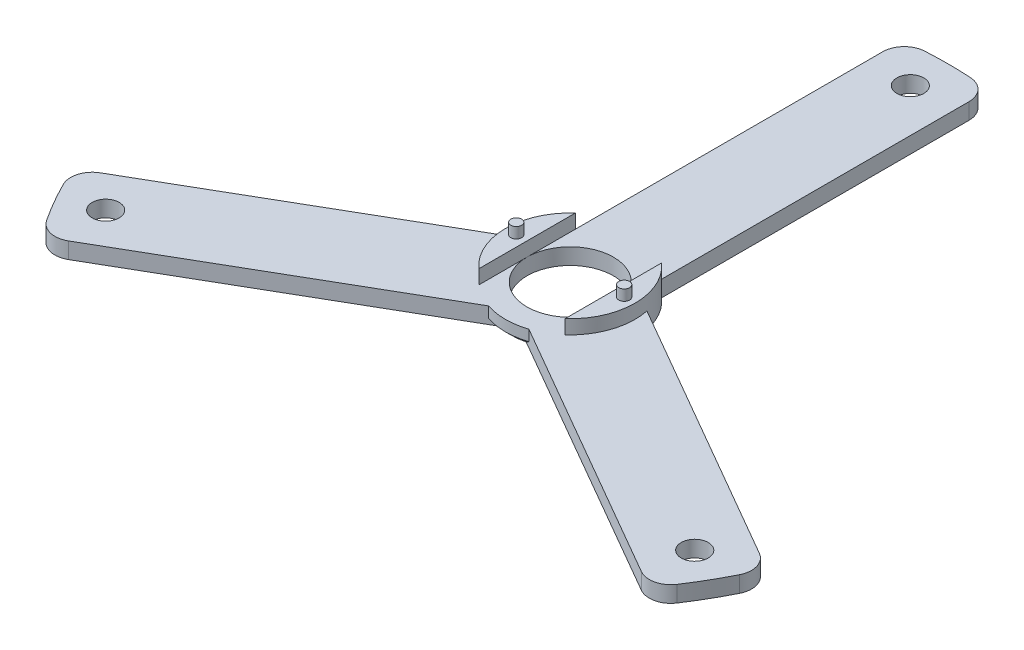
from build123d import *

# Parameters (mm, degrees)
EXTRUDE_1_DEPTH          = 1.5
FILLET_1_R               = 2
CUT_EXTRUDE_1_DEPTH      = 48.129161057
CUT_EXTRUDE_1_DEPTH_BACK = 48.129161057
SKETCH_2_R               = 1.25
EXTRUDE_2_DEPTH          = 1.3
SKETCH_5_R               = 0.5
EXTRUDE_3_DEPTH          = 1
CUT_EXTRUDE_2_DEPTH      = 48.161401823
CUT_EXTRUDE_2_DEPTH_BACK = 48.161401823
SKETCH_6_R               = 4
CHAMFER_1_SIZE           = 0.5


with BuildPart() as part:
    # 草图1 → 凸台-拉伸1 (new body)
    with BuildSketch(Plane(origin=(0, 0, 0), x_dir=(1, 0, 0), z_dir=(0, 1, 0))):
        with BuildLine():
            Line((4, 4.472135955), (4, 34.770677301))
            ThreePointArc((4, 34.770677301), (0, 35), (-4, 34.770677301))
            Line((-4, 34.770677301), (-4, 4.472135955))
            ThreePointArc((-4, 4.472135955), (-5.196152423, 3), (-5.872983346, 1.228033638))
            Line((-5.872983346, 1.228033638), (-32.11228985, -13.921237036))
            ThreePointArc((-32.11228985, -13.921237036), (-30.310889132, -17.5), (-28.11228985, -20.849440266))
            Line((-28.11228985, -20.849440266), (-1.872983346, -5.700169593))
            ThreePointArc((-1.872983346, -5.700169593), (0, -6), (1.872983346, -5.700169593))
            Line((1.872983346, -5.700169593), (28.11228985, -20.849440266))
            ThreePointArc((28.11228985, -20.849440266), (30.310889132, -17.5), (32.11228985, -13.921237036))
            Line((32.11228985, -13.921237036), (5.872983346, 1.228033638))
            ThreePointArc((5.872983346, 1.228033638), (5.196152423, 3), (4, 4.472135955))
        make_face()
    extrude(amount=EXTRUDE_1_DEPTH)

    # 圆角1
    fillet_1_edges = [part.edges().sort_by_distance(p)[0] for p in [
        (32.11228985, 0.75, 13.921237036),
        (28.11228985, 0.75, 20.849440266),
        (-28.11228985, 0.75, 20.849440266),
        (-32.11228985, 0.75, 13.921237036),
        (-4, 0.75, -34.770677301),
        (4, 0.75, -34.770677301),
    ]]
    fillet(fillet_1_edges, radius=FILLET_1_R)

    # 草图2 → 切除-拉伸1 (cut, two sides: drawn at the far end of the back side and taken through both)
    with BuildSketch(Plane(origin=(0, 1.5, 0), x_dir=(1, 0, 0), z_dir=(0, 1, 0)).offset(-CUT_EXTRUDE_1_DEPTH_BACK)):
        with Locations(Location((0, 31.5, 0), (0, 0, 270))):
            Circle(SKETCH_2_R)
        with Locations(Location((27.279800219, -15.75, 0), (0, 0, 270))):
            Circle(SKETCH_2_R)
        with Locations(Location((-27.279800219, -15.75, 0), (0, 0, 270))):
            Circle(SKETCH_2_R)
    extrude(amount=CUT_EXTRUDE_1_DEPTH + CUT_EXTRUDE_1_DEPTH_BACK, mode=Mode.SUBTRACT)

    # 草图4 → 凸台-拉伸2 (add)
    with BuildSketch(Plane(origin=(0, 1.5, 0), x_dir=(1, 0, 0), z_dir=(0, 1, 0))):
        with BuildLine():
            Line((-4, 4.472135955), (-4, -4.472135955))
            ThreePointArc((-4, -4.472135955), (-6, 0), (-4, 4.472135955))
        make_face()
        with BuildLine():
            Line((4, 4.472135955), (4, -4.472135955))
            ThreePointArc((4, -4.472135955), (6, 0), (4, 4.472135955))
        make_face()
    extrude(amount=EXTRUDE_2_DEPTH)

    # 草图5 → 凸台-拉伸3 (add)
    with BuildSketch(Plane(origin=(0, 2.8, 0), x_dir=(1, 0, 0), z_dir=(0, 1, 0))):
        with Locations(Location((5, 0, 0), (0, 0, 270))):
            Circle(SKETCH_5_R)
        with Locations(Location((-5, 0, 0), (0, 0, 90))):
            Circle(SKETCH_5_R)
    extrude(amount=EXTRUDE_3_DEPTH)

    # 草图6 → 切除-拉伸2 (cut, two sides: drawn at the far end of the back side and taken through both)
    with BuildSketch(Plane(origin=(0, 1.5, 0), x_dir=(1, 0, 0), z_dir=(0, 1, 0)).offset(-CUT_EXTRUDE_2_DEPTH_BACK)):
        with Locations(Location((0, 0, 0), (0, 0, 270))):
            Circle(SKETCH_6_R)
    extrude(amount=CUT_EXTRUDE_2_DEPTH + CUT_EXTRUDE_2_DEPTH_BACK, mode=Mode.SUBTRACT)

    # 倒角1
    chamfer_1_edges = [part.edges().sort_by_distance(p)[0] for p in [
        (0, 0, 6),
    ]]
    chamfer(chamfer_1_edges, length=CHAMFER_1_SIZE)


solid = part.part
